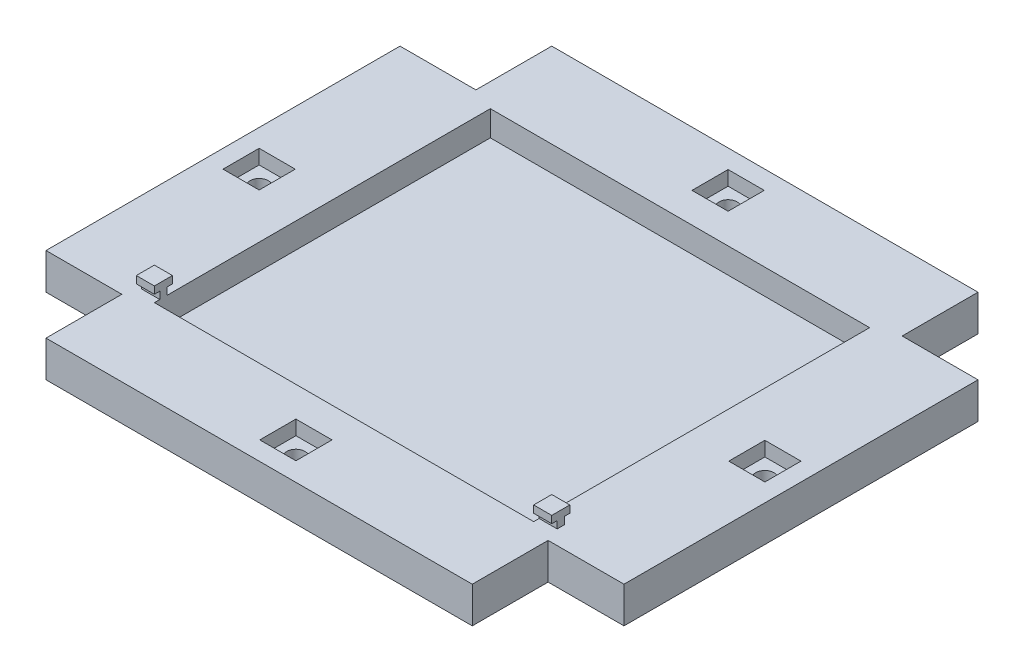
from build123d import *

# Parameters (mm, degrees)
SKETCH2_R           = 2.5
BOSS_EXTRUDE1_DEPTH = 10
SKETCH9_W           = 10
SKETCH9_H           = 10
CUT_EXTRUDE1_DEPTH  = 4
SKETCH11_W          = 105
SKETCH11_H          = 93
CUT_EXTRUDE2_DEPTH  = 7
SKETCH12_W          = 5
SKETCH12_H          = 2
BOSS_EXTRUDE2_DEPTH = 2
SKETCH13_W          = 5
SKETCH13_H          = 5
BOSS_EXTRUDE3_DEPTH = 2


with BuildPart() as part:
    # Sketch2 → Boss-Extrude1 (new body)
    with BuildSketch(Plane(origin=(0, 0, 0), x_dir=(1, 0, 0), z_dir=(0, 1, 0))):
        Polygon((-59, 70), (-59, 49), (-80, 49), (-80, -49), (-59, -49), (-59, -70), (59, -70), (59, -49), (80, -49), (80, 49), (59, 49), (59, 70), align=None)
        with Locations(Location((0, 59.819243353, 0), (0, 0, 270))):
            Circle(SKETCH2_R, mode=Mode.SUBTRACT)
        with Locations(Location((0, -59.819243353, 0), (0, 0, 90))):
            Circle(SKETCH2_R, mode=Mode.SUBTRACT)
        with Locations(Location((-70, 0, 0), (0, 0, 270))):
            Circle(SKETCH2_R, mode=Mode.SUBTRACT)
        with Locations(Location((70, 0, 0), (0, 0, 90))):
            Circle(SKETCH2_R, mode=Mode.SUBTRACT)
    extrude(amount=BOSS_EXTRUDE1_DEPTH)

    # Sketch9 → Cut-Extrude1 (cut)
    with BuildSketch(Plane(origin=(0, 10, 0), x_dir=(1, 0, 0), z_dir=(0, 1, 0))):
        with Locations((0, 59.819243353)):
            Rectangle(SKETCH9_W, SKETCH9_H)
        with Locations((-70, 0)):
            Rectangle(SKETCH9_W, SKETCH9_H)
        with Locations((70, 0)):
            Rectangle(SKETCH9_W, SKETCH9_H)
        with Locations((0, -59.819243353)):
            Rectangle(SKETCH9_W, SKETCH9_H)
    extrude(amount=-CUT_EXTRUDE1_DEPTH, mode=Mode.SUBTRACT)

    # Sketch11 → Cut-Extrude2 (cut)
    with BuildSketch(Plane(origin=(0, 10, 0), x_dir=(1, 0, 0), z_dir=(0, 1, 0))):
        Rectangle(SKETCH11_W, SKETCH11_H)
    extrude(amount=-CUT_EXTRUDE2_DEPTH, mode=Mode.SUBTRACT)

    # Sketch12 → Boss-Extrude2 (add)
    with BuildSketch(Plane(origin=(0, 10, 0), x_dir=(1, 0, 0), z_dir=(0, 1, 0))):
        with Locations((-55, -44)):
            Rectangle(SKETCH12_W, SKETCH12_H)
        with Locations((55, -44)):
            Rectangle(SKETCH12_W, SKETCH12_H)
    extrude(amount=BOSS_EXTRUDE2_DEPTH)

    # Sketch13 → Boss-Extrude3 (add)
    with BuildSketch(Plane(origin=(0, 12, 0), x_dir=(1, 0, 0), z_dir=(0, 1, 0))):
        with Locations((-55, -44)):
            Rectangle(SKETCH13_W, SKETCH13_H)
        with Locations((55, -44)):
            Rectangle(SKETCH13_W, SKETCH13_H)
    extrude(amount=BOSS_EXTRUDE3_DEPTH)


solid = part.part
